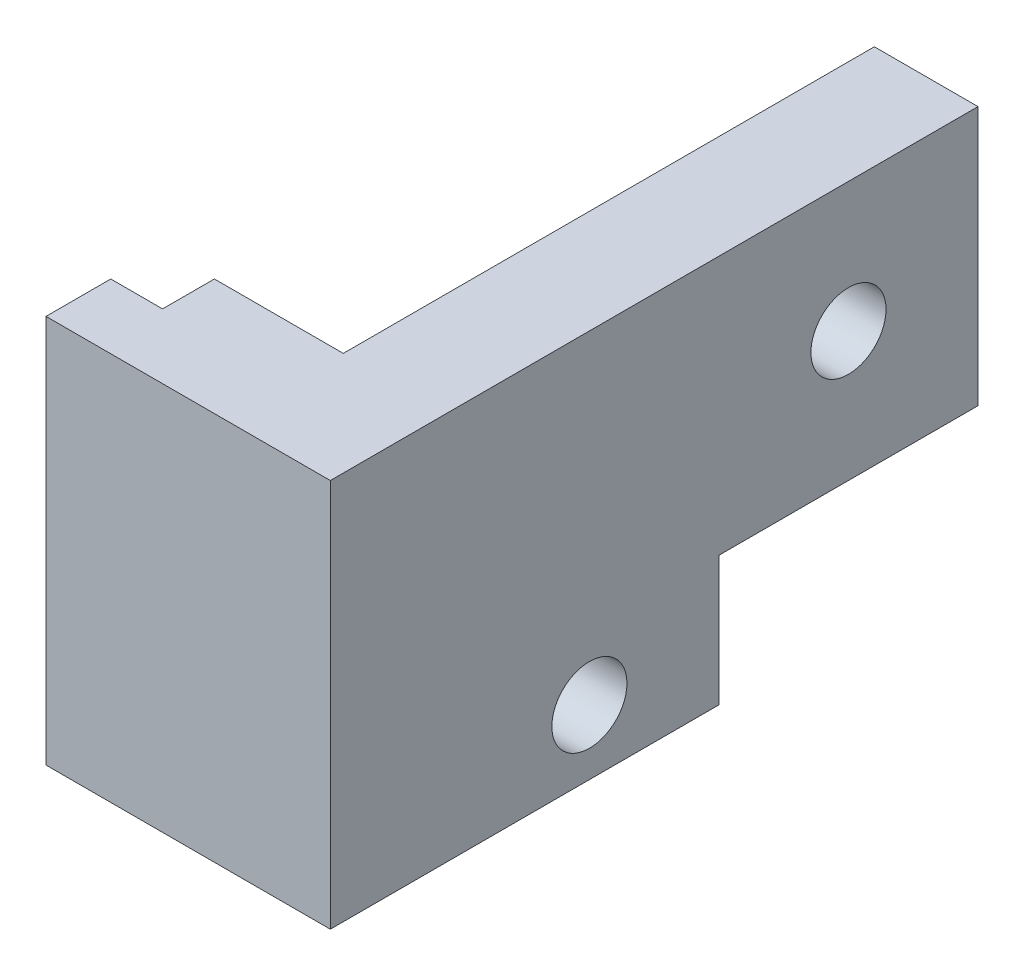
from build123d import *

# Parameters (mm, degrees)
SKETCH_1_W           = 40
SKETCH_1_H           = 30
EXTRUDE_1_DEPTH      = 5
SKETCH_2_W           = 5
SKETCH_2_H           = 30
EXTRUDE_2_DEPTH      = 20
SKETCH_3_W           = 20
SKETCH_3_H           = 30
EXTRUDE_3_DEPTH      = 5
SKETCH_4_W           = 15
SKETCH_4_H           = 30
CUT_EXTRUDE_1_DEPTH  = 5
SKETCH_6_R           = 1.5
CUT_EXTRUDE_3_DEPTH  = 5
SKETCH_7_W           = 15
SKETCH_7_H           = 30
CUT_EXTRUDE_4_DEPTH  = 5
SKETCH_8_W           = 5
SKETCH_8_H           = 30
EXTRUDE_4_DEPTH      = 20
SKETCH_9_W           = 30
SKETCH_9_H           = 30
EXTRUDE_5_DEPTH      = 3
SKETCH_10_R          = 1.5
CUT_EXTRUDE_5_DEPTH  = 13
SKETCH_11_R          = 2.9
CUT_EXTRUDE_6_DEPTH  = 6
SKETCH_12_W          = 8
SKETCH_12_H          = 20
EXTRUDE_6_DEPTH      = 20
CUT_EXTRUDE_7_DEPTH  = 4.2
SKETCH_14_R          = 1.5
CUT_EXTRUDE_8_DEPTH  = 14.2
SKETCH_15_R          = 2.9
CUT_EXTRUDE_9_DEPTH  = 6
SKETCH_16_W          = 4
SKETCH_16_H          = 30
EXTRUDE_7_DEPTH      = 9.95
SKETCH_17_W          = 5
SKETCH_17_H          = 30
CUT_EXTRUDE_10_DEPTH = 26.05


with BuildPart() as part:
    # 草图1 → 凸台-拉伸1 (new body)
    with BuildSketch(Plane.XY):
        with Locations((-20, 15)):
            Rectangle(SKETCH_1_W, SKETCH_1_H)
    extrude(amount=EXTRUDE_1_DEPTH)

    # 草图2 → 凸台-拉伸2 (add)
    with BuildSketch(Plane.ZY.offset(40)):
        with Locations((2.5, 15)):
            Rectangle(SKETCH_2_W, SKETCH_2_H)
    extrude(amount=EXTRUDE_2_DEPTH)

    # 草图3 → 凸台-拉伸3 (add)
    with BuildSketch(Plane(origin=(0, 0, 0), x_dir=(-1, 0, 0), z_dir=(0, 0, -1))):
        with Locations((10, 15)):
            Rectangle(SKETCH_3_W, SKETCH_3_H)
    extrude(amount=EXTRUDE_3_DEPTH)

    # 草图4 → 切除-拉伸1 (cut)
    with BuildSketch(Plane.XY.offset(5)):
        with Locations((-7.5, 15)):
            Rectangle(SKETCH_4_W, SKETCH_4_H)
    extrude(amount=-CUT_EXTRUDE_1_DEPTH, mode=Mode.SUBTRACT)

    # 草图6 → 切除-拉伸3 (cut)
    with BuildSketch(Plane.XY):
        with Locations((-7.5, 25)):
            Circle(SKETCH_6_R)
        with Locations((-7.5, 5)):
            Circle(SKETCH_6_R)
    extrude(amount=-CUT_EXTRUDE_3_DEPTH, mode=Mode.SUBTRACT)

    # 草图7 → 切除-拉伸4 (cut)
    with BuildSketch(Plane.XY):
        with Locations((-7.5, 15)):
            Rectangle(SKETCH_7_W, SKETCH_7_H)
    extrude(amount=-CUT_EXTRUDE_4_DEPTH, mode=Mode.SUBTRACT)

    # 草图8 → 凸台-拉伸4 (add)
    with BuildSketch(Plane(origin=(0, 0, -5), x_dir=(-1, 0, 0), z_dir=(0, 0, -1))):
        with Locations((17.5, 15)):
            Rectangle(SKETCH_8_W, SKETCH_8_H)
    extrude(amount=EXTRUDE_4_DEPTH)

    # 草图9 → 凸台-拉伸5 (add)
    with BuildSketch(Plane(origin=(-15, 0, 0), x_dir=(0, 0, -1), z_dir=(1, 0, 0))):
        with Locations((10, 15)):
            Rectangle(SKETCH_9_W, SKETCH_9_H)
    extrude(amount=EXTRUDE_5_DEPTH)

    # 草图10 → 切除-拉伸5 (cut)
    with BuildSketch(Plane(origin=(-12, 0, 0), x_dir=(0, 0, -1), z_dir=(1, 0, 0))):
        with Locations((15, 5)):
            Circle(SKETCH_10_R)
    extrude(amount=-CUT_EXTRUDE_5_DEPTH, mode=Mode.SUBTRACT)

    # 草图11 → 切除-拉伸6 (cut)
    with BuildSketch(Plane(origin=(-12, 0, 0), x_dir=(0, 0, -1), z_dir=(1, 0, 0))):
        with Locations((15, 5)):
            Circle(SKETCH_11_R)
    extrude(amount=-CUT_EXTRUDE_6_DEPTH, mode=Mode.SUBTRACT)

    # 草图12 → 凸台-拉伸6 (add)
    with BuildSketch(Plane(origin=(0, 0, -25), x_dir=(-1, 0, 0), z_dir=(0, 0, -1))):
        with Locations((16, 20)):
            Rectangle(SKETCH_12_W, SKETCH_12_H)
    extrude(amount=EXTRUDE_6_DEPTH)

    # 草图13 → 切除-拉伸7 (cut)
    with BuildSketch(Plane.ZY.offset(20)):
        Polygon((-45, 17), (-25, 17), (-18, 17), (-18, 0), (-25, 0), (-25, 10), (-45, 10), align=None)
    extrude(amount=-CUT_EXTRUDE_7_DEPTH, mode=Mode.SUBTRACT)

    # 草图14 → 切除-拉伸8 (cut)
    with BuildSketch(Plane(origin=(-12, 0, 0), x_dir=(0, 0, -1), z_dir=(1, 0, 0))):
        with Locations((35, 20)):
            Circle(SKETCH_14_R)
    extrude(amount=-CUT_EXTRUDE_8_DEPTH, mode=Mode.SUBTRACT)

    # 草图15 → 切除-拉伸9 (cut)
    with BuildSketch(Plane(origin=(-12, 0, 0), x_dir=(0, 0, -1), z_dir=(1, 0, 0))):
        with Locations((35, 20)):
            Circle(SKETCH_15_R)
    extrude(amount=-CUT_EXTRUDE_9_DEPTH, mode=Mode.SUBTRACT)

    # 草图16 → 凸台-拉伸7 (add)
    with BuildSketch(Plane.ZY.offset(20)):
        with Locations((-2, 15)):
            Rectangle(SKETCH_16_W, SKETCH_16_H)
    extrude(amount=EXTRUDE_7_DEPTH)

    # 草图17 → 切除-拉伸10 (cut)
    with BuildSketch(Plane.ZY.offset(60)):
        with Locations((2.5, 15)):
            Rectangle(SKETCH_17_W, SKETCH_17_H)
    extrude(amount=-CUT_EXTRUDE_10_DEPTH, mode=Mode.SUBTRACT)


solid = part.part
